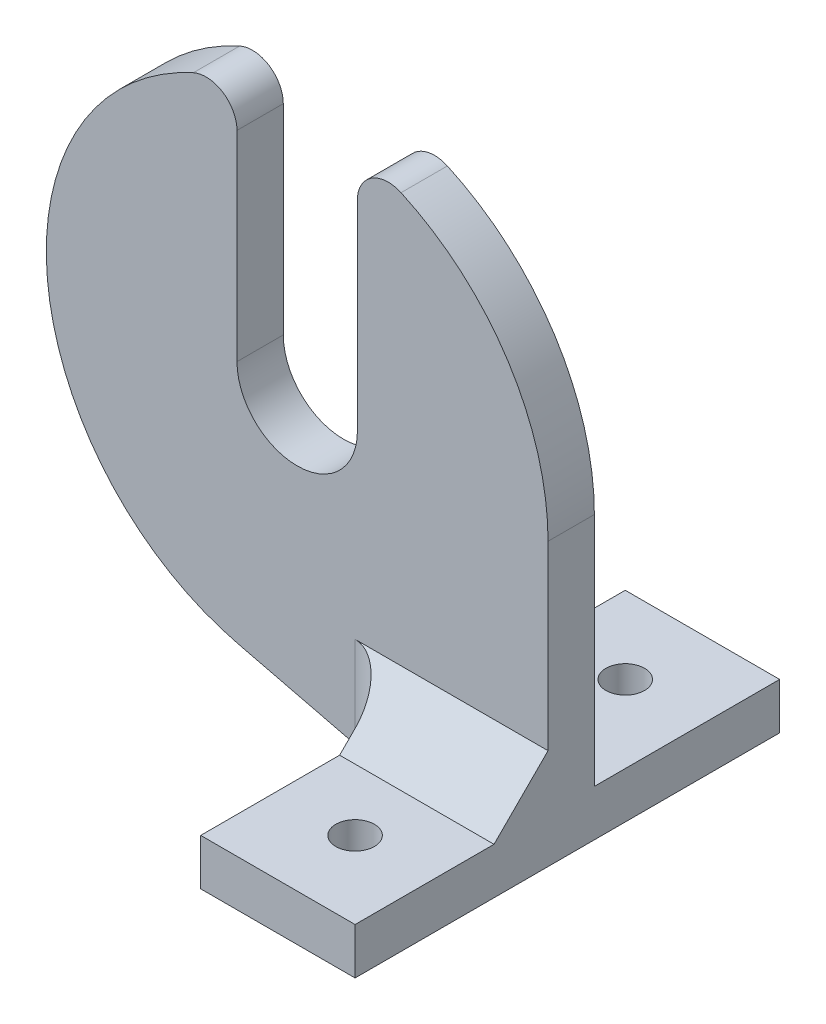
from build123d import *

# Parameters (mm, degrees)
BOSS_EXTRUDE1_DEPTH      = 7.62
BOSS_EXTRUDE2_DEPTH      = 31.75
BOSS_EXTRUDE2_DEPTH_BACK = 38.1
SKETCH2_W                = 25.4
SKETCH2_H                = 7.62
BOSS_EXTRUDE3_START      = -7.62
BOSS_EXTRUDE3_DEPTH      = 7.62
SKETCH4_R                = 3.175
CUT_EXTRUDE1_DEPTH       = 7.62
CHAMFER1_SIZE            = 8.89
FILLET1_R                = 6.35
FILLET2_R                = 5.08


with BuildPart() as part:
    # Sketch1 → Boss-Extrude1 (new body)
    with BuildSketch(Plane.XY):
        with BuildLine():
            Line((41.275, -41.275), (0, -41.275))
            ThreePointArc((0, -41.275), (-40.972302797, -4.989592018), (-9.906, 40.068650951))
            Line((-9.906, 40.068650951), (-9.906, 0))
            ThreePointArc((-9.906, 0), (0, -9.906), (9.906, 0))
            Line((9.906, 0), (9.906, 40.068650951))
            ThreePointArc((9.906, 40.068650951), (32.4999675, 25.443618797), (41.275, 0))
            Line((41.275, 0), (41.275, -41.275))
        make_face()
    extrude(amount=BOSS_EXTRUDE1_DEPTH)

    # Sketch2 → Boss-Extrude2 (add, two sides: drawn at the far end of the back side and taken through both)
    with BuildSketch(Plane.XY.offset(7.62).offset(-BOSS_EXTRUDE2_DEPTH_BACK)):
        with Locations((28.575, -42.545)):
            Rectangle(SKETCH2_W, SKETCH2_H)
    extrude(amount=BOSS_EXTRUDE2_DEPTH + BOSS_EXTRUDE2_DEPTH_BACK)

    # Sketch3 → Boss-Extrude3 (add)
    with BuildSketch(Plane.XY.offset(7.62).offset(BOSS_EXTRUDE3_START)):
        with BuildLine():
            Line((15.875, -46.355), (-9.77755074, -40.10018861))
            ThreePointArc((-9.77755074, -40.10018861), (-4.923938471, -40.980244691), (0, -41.275))
            Line((0, -41.275), (15.875, -41.275))
            Line((15.875, -41.275), (15.875, -46.355))
        make_face()
    extrude(amount=BOSS_EXTRUDE3_DEPTH)

    # Sketch4 → Cut-Extrude1 (cut)
    with BuildSketch(Plane(origin=(0, -38.735, 0), x_dir=(1, 0, 0), z_dir=(0, 1, 0))):
        with Locations(Location((28.575, -26.67, 0), (0, 0, 270))):
            Circle(SKETCH4_R)
        with Locations(Location((28.575, 17.78, 0), (0, 0, 270))):
            Circle(SKETCH4_R)
    extrude(amount=-CUT_EXTRUDE1_DEPTH, mode=Mode.SUBTRACT)

    # Chamfer1
    chamfer1_edges = [part.edges().sort_by_distance(p)[0] for p in [
        (28.575, -38.735, 7.62),
    ]]
    chamfer(chamfer1_edges, length=CHAMFER1_SIZE)

    # Fillet1
    fillet1_edges = [part.edges().sort_by_distance(p)[0] for p in [
        (15.875, -42.545, 0),
        (15.875, -38.1, 7.62),
    ]]
    fillet(fillet1_edges, radius=FILLET1_R)

    # Fillet2
    fillet2_edges = [part.edges().sort_by_distance(p)[0] for p in [
        (9.906, 40.068650951, 3.81),
        (-9.906, 40.068650951, 3.81),
    ]]
    fillet(fillet2_edges, radius=FILLET2_R)


solid = part.part
